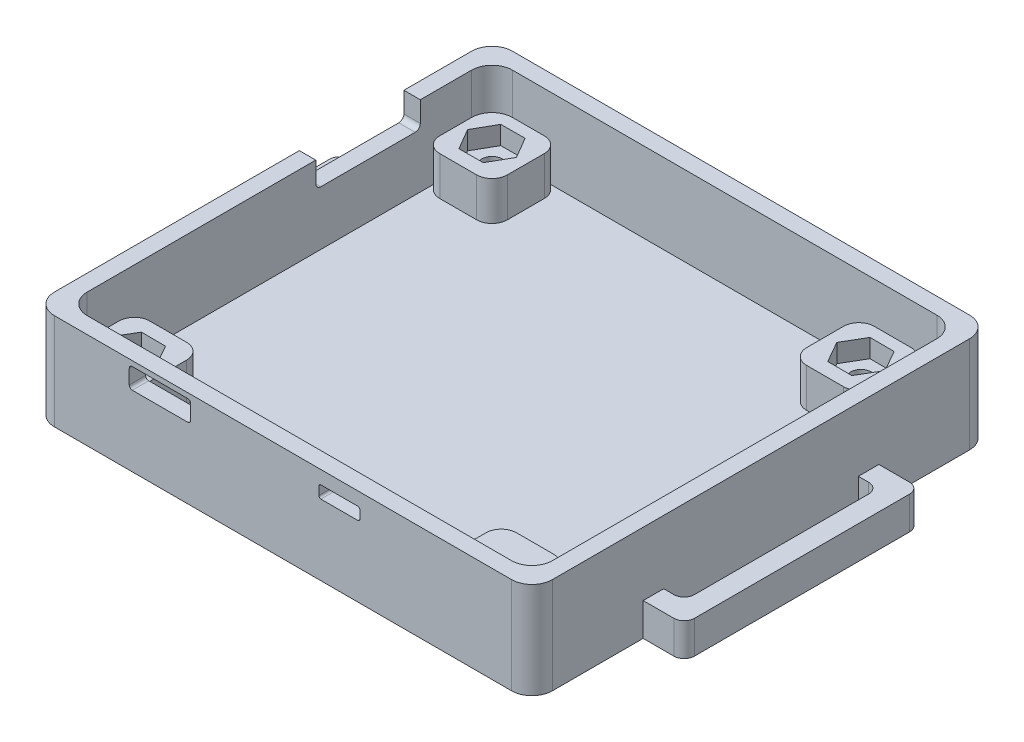
from build123d import *

# Parameters (mm, degrees)
EXTRUDE_1_DEPTH     = 9.4
CUT_EXTRUDE_1_DEPTH = 7.8
EXTRUDE_2_DEPTH     = 3.8
CUT_EXTRUDE_2_DEPTH = 1.8
SKETCH_5_R          = 1
CUT_EXTRUDE_4_DEPTH = 3.8
CUT_EXTRUDE_5_DEPTH = 2.8
CUT_EXTRUDE_6_DEPTH = 2.8
CUT_EXTRUDE_7_DEPTH = 2.8
EXTRUDE_3_DEPTH     = 1.6
CUT_EXTRUDE_8_DEPTH = 3.2


with BuildPart() as part:
    # 草图1 → 凸台-拉伸1 (new body)
    with BuildSketch(Plane(origin=(0, 0, 0), x_dir=(1, 0, 0), z_dir=(0, 1, 0))):
        with BuildLine():
            Line((-22.3, -22.35), (22.3, -22.35))
            ThreePointArc((22.3, -22.35), (23.714213562, -21.764213562), (24.3, -20.35))
            Line((24.3, -20.35), (24.3, 20.35))
            ThreePointArc((24.3, 20.35), (23.714213562, 21.764213562), (22.3, 22.35))
            Line((22.3, 22.35), (-22.3, 22.35))
            ThreePointArc((-22.3, 22.35), (-23.714213562, 21.764213562), (-24.3, 20.35))
            Line((-24.3, 20.35), (-24.3, -20.35))
            ThreePointArc((-24.3, -20.35), (-23.714213562, -21.764213562), (-22.3, -22.35))
        make_face()
    extrude(amount=EXTRUDE_1_DEPTH)

    # 草图2 → 切除-拉伸1 (cut)
    with BuildSketch(Plane(origin=(0, 9.4, 0), x_dir=(1, 0, 0), z_dir=(0, 1, 0))):
        with BuildLine():
            Line((-20.7, -20.75), (20.7, -20.75))
            ThreePointArc((20.7, -20.75), (22.114213562, -20.164213562), (22.7, -18.75))
            Line((22.7, -18.75), (22.7, 18.75))
            ThreePointArc((22.7, 18.75), (22.114213562, 20.164213562), (20.7, 20.75))
            Line((20.7, 20.75), (-20.7, 20.75))
            ThreePointArc((-20.7, 20.75), (-22.114213562, 20.164213562), (-22.7, 18.75))
            Line((-22.7, 18.75), (-22.7, -18.75))
            ThreePointArc((-22.7, -18.75), (-22.114213562, -20.164213562), (-20.7, -20.75))
        make_face()
    extrude(amount=-CUT_EXTRUDE_1_DEPTH, mode=Mode.SUBTRACT)

    # 草图3 → 凸台-拉伸2 (add)
    with BuildSketch(Plane(origin=(0, 1.6, 0), x_dir=(1, 0, 0), z_dir=(0, 1, 0))):
        with BuildLine():
            Line((-21.2, -14.15), (-17.6, -14.15))
            ThreePointArc((-17.6, -14.15), (-16.539339828, -14.589339828), (-16.1, -15.65))
            Line((-16.1, -15.65), (-16.1, -19.25))
            ThreePointArc((-16.1, -19.25), (-16.539339828, -20.310660172), (-17.6, -20.75))
            Line((-17.6, -20.75), (-22.7, -20.75))
            Line((-22.7, -20.75), (-22.7, -15.65))
            ThreePointArc((-22.7, -15.65), (-22.260660172, -14.589339828), (-21.2, -14.15))
        make_face()
        with BuildLine():
            Line((-22.7, 20.75), (-17.6, 20.75))
            ThreePointArc((-17.6, 20.75), (-16.539339828, 20.310660172), (-16.1, 19.25))
            Line((-16.1, 19.25), (-16.1, 15.65))
            ThreePointArc((-16.1, 15.65), (-16.539339828, 14.589339828), (-17.6, 14.15))
            Line((-17.6, 14.15), (-21.2, 14.15))
            ThreePointArc((-21.2, 14.15), (-22.260660172, 14.589339828), (-22.7, 15.65))
            Line((-22.7, 15.65), (-22.7, 20.75))
        make_face()
        with BuildLine():
            Line((19.7, 15.65), (19.7, 19.25))
            ThreePointArc((19.7, 19.25), (19.260660172, 20.310660172), (18.2, 20.75))
            Line((18.2, 20.75), (14.6, 20.75))
            ThreePointArc((14.6, 20.75), (13.539339828, 20.310660172), (13.1, 19.25))
            Line((13.1, 19.25), (13.1, 15.65))
            ThreePointArc((13.1, 15.65), (13.539339828, 14.589339828), (14.6, 14.15))
            Line((14.6, 14.15), (18.2, 14.15))
            ThreePointArc((18.2, 14.15), (19.260660172, 14.589339828), (19.7, 15.65))
        make_face()
        with BuildLine():
            Line((18.2, -14.15), (14.6, -14.15))
            ThreePointArc((14.6, -14.15), (13.539339828, -14.589339828), (13.1, -15.65))
            Line((13.1, -15.65), (13.1, -19.25))
            ThreePointArc((13.1, -19.25), (13.539339828, -20.310660172), (14.6, -20.75))
            Line((14.6, -20.75), (18.2, -20.75))
            ThreePointArc((18.2, -20.75), (19.260660172, -20.310660172), (19.7, -19.25))
            Line((19.7, -19.25), (19.7, -15.65))
            ThreePointArc((19.7, -15.65), (19.260660172, -14.589339828), (18.2, -14.15))
        make_face()
    extrude(amount=EXTRUDE_2_DEPTH)

    # 草图4 → 切除-拉伸2 (cut)
    with BuildSketch(Plane(origin=(0, 5.4, 0), x_dir=(1, 0, 0), z_dir=(0, 1, 0))):
        Polygon((-18.328981591, -19.607194502), (-17.132908096, -17.564465561), (-18.303926505, -15.507271059), (-20.671018409, -15.492805498), (-21.867091904, -17.535534439), (-20.696073495, -19.592728941), align=None)
        Polygon((-20.696073495, 19.592728941), (-18.328981591, 19.607194502), (-17.132908096, 17.564465561), (-18.303926505, 15.507271059), (-20.671018409, 15.492805498), (-21.867091904, 17.535534439), align=None)
        Polygon((18.867091904, 17.535534439), (17.696073495, 19.592728941), (15.328981591, 19.607194502), (14.132908096, 17.564465561), (15.303926505, 15.507271059), (17.671018409, 15.492805498), align=None)
    extrude(amount=-CUT_EXTRUDE_2_DEPTH, mode=Mode.SUBTRACT)

    # 草图5 → 切除-拉伸4 (cut)
    with BuildSketch(Plane(origin=(0, 5.4, 0), x_dir=(1, 0, 0), z_dir=(0, 1, 0))):
        with Locations(Location((-19.5, -17.55, 0), (0, 0, 270))):
            Circle(SKETCH_5_R)
        with Locations(Location((-19.5, 17.55, 0), (0, 0, 270))):
            Circle(SKETCH_5_R)
        with Locations(Location((16.5, 17.55, 0), (0, 0, 270))):
            Circle(SKETCH_5_R)
    extrude(amount=-CUT_EXTRUDE_4_DEPTH, mode=Mode.SUBTRACT)

    # 草图6 → 切除-拉伸5 (cut)
    with BuildSketch(Plane.ZY.offset(24.3)):
        with BuildLine():
            Line((-13.25, 6.9), (-4.05, 6.9))
            ThreePointArc((-4.05, 6.9), (-3.696446609, 7.046446609), (-3.55, 7.4))
            Line((-3.55, 7.4), (-3.55, 10.4))
            Line((-3.55, 10.4), (-13.75, 10.4))
            Line((-13.75, 10.4), (-13.75, 7.4))
            ThreePointArc((-13.75, 7.4), (-13.603553391, 7.046446609), (-13.25, 6.9))
        make_face()
    extrude(amount=-CUT_EXTRUDE_5_DEPTH, mode=Mode.SUBTRACT)

    # 草图7 → 切除-拉伸6 (cut)
    with BuildSketch(Plane.XY.offset(22.35)):
        with BuildLine():
            Line((-14.7, 8.9), (-9.3, 8.9))
            ThreePointArc((-9.3, 8.9), (-9.087867966, 8.812132034), (-9, 8.6))
            Line((-9, 8.6), (-9, 7.2))
            ThreePointArc((-9, 7.2), (-9.087867966, 6.987867966), (-9.3, 6.9))
            Line((-9.3, 6.9), (-14.7, 6.9))
            ThreePointArc((-14.7, 6.9), (-14.912132034, 6.987867966), (-15, 7.2))
            Line((-15, 7.2), (-15, 8.6))
            ThreePointArc((-15, 8.6), (-14.912132034, 8.812132034), (-14.7, 8.9))
        make_face()
    extrude(amount=-CUT_EXTRUDE_6_DEPTH, mode=Mode.SUBTRACT)

    # 草图8 → 切除-拉伸7 (cut)
    with BuildSketch(Plane.XY.offset(22.35)):
        with BuildLine():
            Line((3.7, 8.1), (7.3, 8.1))
            ThreePointArc((7.3, 8.1), (7.441421356, 8.041421356), (7.5, 7.9))
            Line((7.5, 7.9), (7.5, 7.1))
            ThreePointArc((7.5, 7.1), (7.441421356, 6.958578644), (7.3, 6.9))
            Line((7.3, 6.9), (3.7, 6.9))
            ThreePointArc((3.7, 6.9), (3.558578644, 6.958578644), (3.5, 7.1))
            Line((3.5, 7.1), (3.5, 7.9))
            ThreePointArc((3.5, 7.9), (3.558578644, 8.041421356), (3.7, 8.1))
        make_face()
    extrude(amount=-CUT_EXTRUDE_7_DEPTH, mode=Mode.SUBTRACT)

    # 草图12 → 凸台-拉伸3 (add, symmetric)
    with BuildSketch(Plane(origin=(0, 1.6, 0), x_dir=(1, 0, 0), z_dir=(0, 1, 0))):
        with BuildLine():
            Line((-27.3, 11.5), (-24.3, 11.5))
            Line((-24.3, 11.5), (-24.3, -11.5))
            Line((-24.3, -11.5), (-27.3, -11.5))
            ThreePointArc((-27.3, -11.5), (-28.007106781, -11.207106781), (-28.3, -10.5))
            Line((-28.3, -10.5), (-28.3, 10.5))
            ThreePointArc((-28.3, 10.5), (-28.007106781, 11.207106781), (-27.3, 11.5))
        make_face()
        with BuildLine():
            Line((27.3, -11.5), (24.3, -11.5))
            Line((24.3, -11.5), (24.3, 11.5))
            Line((24.3, 11.5), (27.3, 11.5))
            ThreePointArc((27.3, 11.5), (28.007106781, 11.207106781), (28.3, 10.5))
            Line((28.3, 10.5), (28.3, -10.5))
            ThreePointArc((28.3, -10.5), (28.007106781, -11.207106781), (27.3, -11.5))
        make_face()
    extrude(amount=EXTRUDE_3_DEPTH, both=True)

    # 草图13 → 切除-拉伸8 (cut)
    with BuildSketch(Plane(origin=(0, 3.2, 0), x_dir=(1, 0, 0), z_dir=(0, 1, 0))):
        with BuildLine():
            Line((-25.3, 9.5), (-24.3, 9.5))
            Line((-24.3, 9.5), (-24.3, -9.5))
            Line((-24.3, -9.5), (-25.3, -9.5))
            ThreePointArc((-25.3, -9.5), (-26.007106781, -9.207106781), (-26.3, -8.5))
            Line((-26.3, -8.5), (-26.3, 8.5))
            ThreePointArc((-26.3, 8.5), (-26.007106781, 9.207106781), (-25.3, 9.5))
        make_face()
        with BuildLine():
            Line((25.3, -9.5), (24.3, -9.5))
            Line((24.3, -9.5), (24.3, 9.5))
            Line((24.3, 9.5), (25.3, 9.5))
            ThreePointArc((25.3, 9.5), (26.007106781, 9.207106781), (26.3, 8.5))
            Line((26.3, 8.5), (26.3, -8.5))
            ThreePointArc((26.3, -8.5), (26.007106781, -9.207106781), (25.3, -9.5))
        make_face()
    extrude(amount=-CUT_EXTRUDE_8_DEPTH, mode=Mode.SUBTRACT)


solid = part.part
